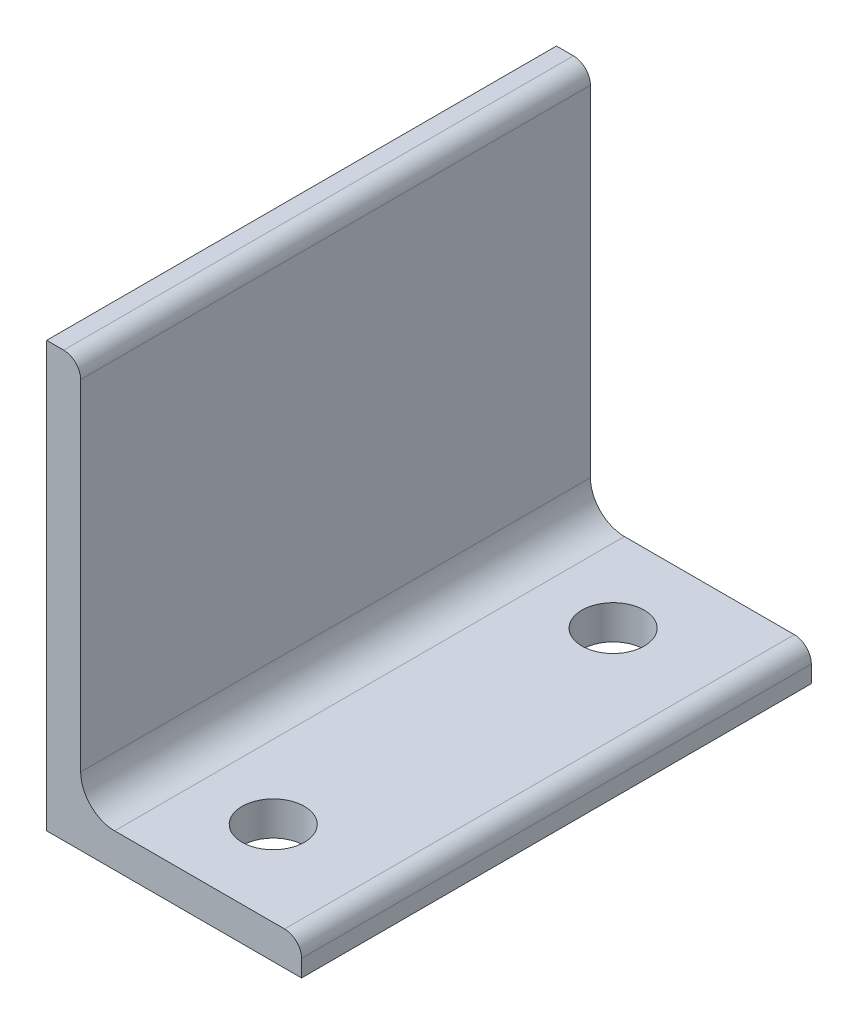
from build123d import *

# Parameters (mm, degrees)
BOSS_EXTRUDE1_DEPTH = 90
CUT_EXTRUDE1_REACH  = 172.789
SKETCH2_R           = 11


with BuildPart() as part:
    # Sketch1 → Boss-Extrude1 (new, symmetric)
    with BuildSketch(Plane.XY):
        with BuildLine():
            Line((-45, 75), (-45, -75))
            Line((-45, -75), (45, -75))
            Line((45, -75), (45, -69))
            ThreePointArc((45, -69), (43.242640687, -64.757359313), (39, -63))
            Line((39, -63), (-21, -63))
            ThreePointArc((-21, -63), (-29.485281374, -59.485281374), (-33, -51))
            Line((-33, -51), (-33, 69))
            ThreePointArc((-33, 69), (-34.757359313, 73.242640687), (-39, 75))
            Line((-39, 75), (-45, 75))
        make_face()
    extrude(amount=BOSS_EXTRUDE1_DEPTH, both=True)

    # Sketch2 → Cut-Extrude1 (cut, up to next)
    with BuildSketch(Plane(origin=(0, -63, 0), x_dir=(1, 0, 0), z_dir=(0, 1, 0)), mode=Mode.PRIVATE) as cut_extrude1_sk1:
        with Locations(Location((5, -60, 0), (0, 0, 180))):
            Circle(SKETCH2_R)
    cut_extrude1_tool1 = extrude(cut_extrude1_sk1.sketch, amount=-CUT_EXTRUDE1_REACH, mode=Mode.PRIVATE) & part.part
    # Sketch2 → Cut-Extrude1 (cut, up to next)
    with BuildSketch(Plane(origin=(0, -63, 0), x_dir=(1, 0, 0), z_dir=(0, 1, 0)), mode=Mode.PRIVATE) as cut_extrude1_sk2:
        with Locations(Location((5, 60, 0), (0, 0, 180))):
            Circle(SKETCH2_R)
    cut_extrude1_tool2 = extrude(cut_extrude1_sk2.sketch, amount=-CUT_EXTRUDE1_REACH, mode=Mode.PRIVATE) & part.part
    add(cut_extrude1_tool1.solids().sort_by_distance((5, -63, 60))[0], mode=Mode.SUBTRACT)
    add(cut_extrude1_tool2.solids().sort_by_distance((5, -63, -60))[0], mode=Mode.SUBTRACT)


solid = part.part
